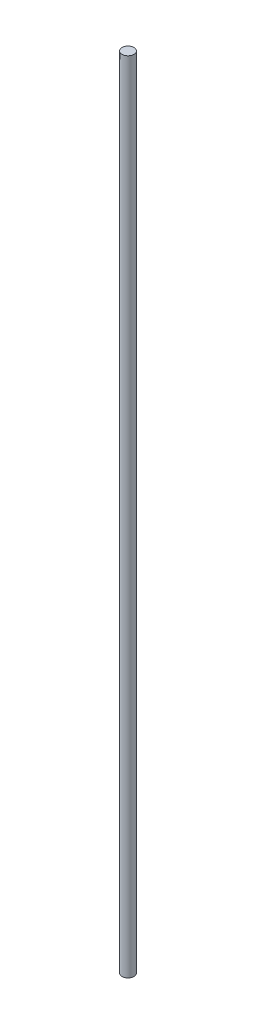
from build123d import *

# Parameters (mm, degrees)
SKETCH1_R           = 1.5
BOSS_EXTRUDE1_DEPTH = 200


with BuildPart() as part:
    # Sketch1 → Boss-Extrude1 (new body)
    with BuildSketch(Plane(origin=(0, 0, 0), x_dir=(1, 0, 0), z_dir=(0, 1, 0))):
        with Locations(Location((0, 0, 0), (0, 0, 270))):
            Circle(SKETCH1_R)
    extrude(amount=BOSS_EXTRUDE1_DEPTH)


solid = part.part
